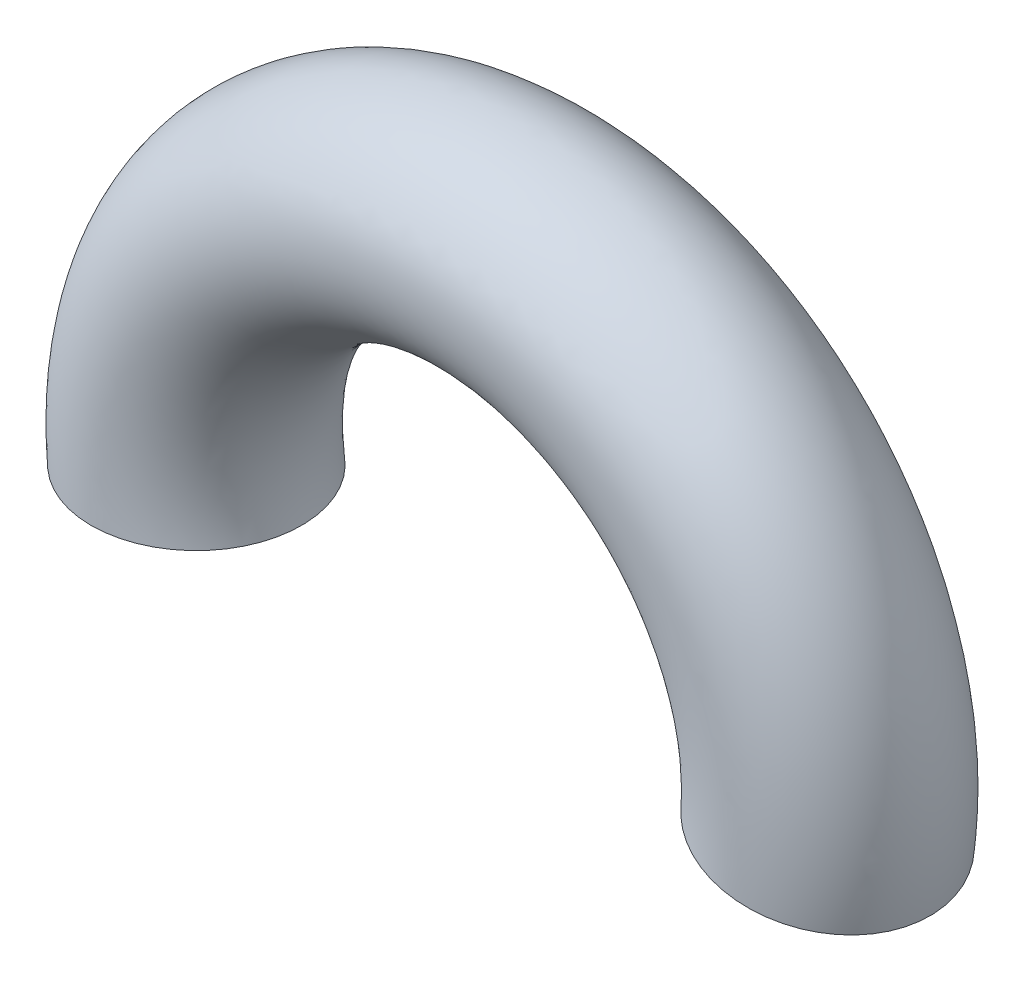
from build123d import *

# Parameters (mm, degrees)
SKETCH1_R = 2


with BuildPart() as part:
    # Sweep1: sweep along a curve in space
    with BuildLine() as sweep1_path:
        ThreePointArc((-7, 0, 0), (-1, 6.72910057, 0), (5, 0, 0))
    # Sketch1 → Sweep1 (sweep)
    with BuildSketch(Plane(origin=(0, 0, 0), x_dir=(1, 0, 0), z_dir=(0, 1, 0))):
        with Locations((-7, 0)):
            Circle(SKETCH1_R)
    sweep(path=sweep1_path.line)


solid = part.part
